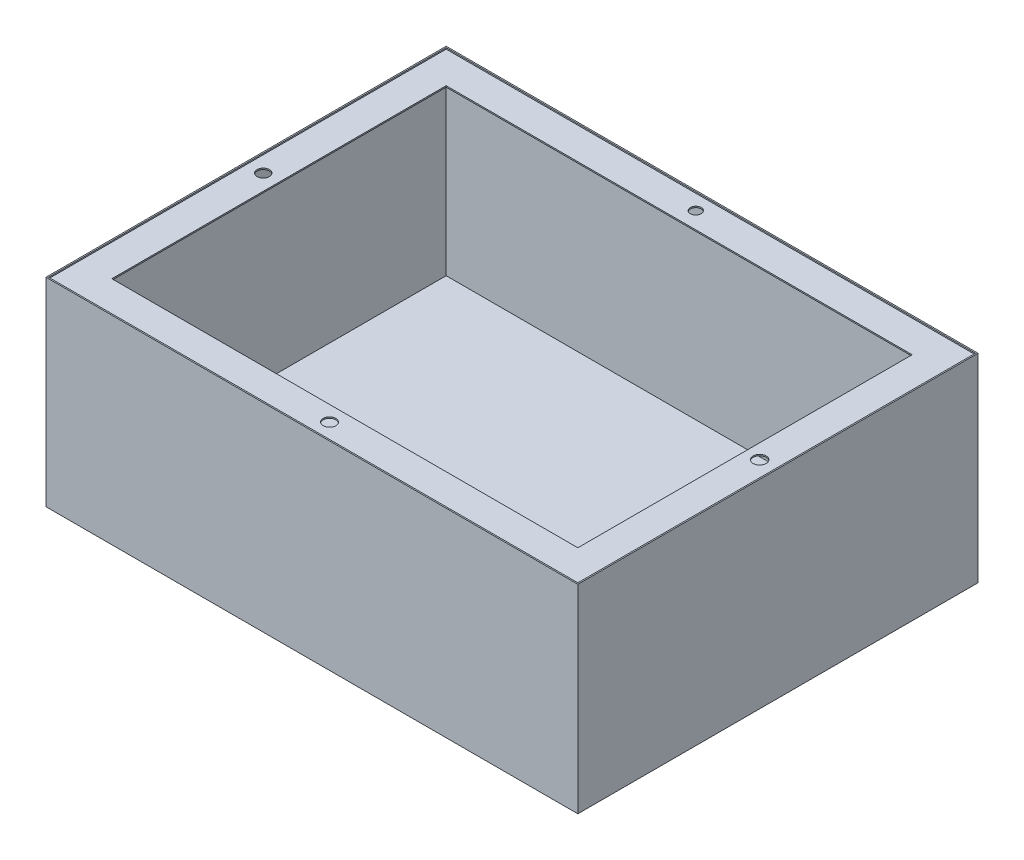
from build123d import *

# Parameters (mm, degrees)
SKETCH1_W           = 410.4
SKETCH1_H           = 308.8
BOSS_EXTRUDE2_DEPTH = 1
SKETCH5_W           = 410.4
SKETCH5_H           = 1
BOSS_EXTRUDE4_DEPTH = 152.4
SKETCH10_W          = 1
SKETCH10_H          = 308.8
EXTRUDE_THIN2_DEPTH = 152.4
SKETCH11_W          = 1
SKETCH11_H          = 307.8
SKETCH11_W_2        = 409.4
SKETCH11_H_2        = 1
EXTRUDE_THIN3_DEPTH = 152.4
SKETCH12_W          = 410.4
SKETCH12_H          = 1
EXTRUDE_THIN4_DEPTH = 25.4
SKETCH13_W          = 308.8
SKETCH13_H          = 1
EXTRUDE_THIN5_DEPTH = 25.4
SKETCH14_W          = 410.4
SKETCH14_H          = 1
EXTRUDE_THIN6_DEPTH = 25.4
SKETCH15_W          = 308.8
SKETCH15_H          = 1
EXTRUDE_THIN7_DEPTH = 25.4
SKETCH19_R          = 5.056095902
SKETCH19_R_2        = 4.737056414
SKETCH19_R_3        = 4.194334137
SKETCH19_R_4        = 4.887308366
CUT_EXTRUDE3_DEPTH  = 10


with BuildPart() as part:
    # Sketch1 → Boss-Extrude2 (new body)
    with BuildSketch(Plane(origin=(0, 0, 0), x_dir=(1, 0, 0), z_dir=(0, 1, 0))):
        Rectangle(SKETCH1_W, SKETCH1_H)
    extrude(amount=BOSS_EXTRUDE2_DEPTH)

    # Sketch5 → Boss-Extrude4 (add)
    with BuildSketch(Plane(origin=(0, 1, 0), x_dir=(1, 0, 0), z_dir=(0, 1, 0))):
        with Locations((0, -153.9)):
            Rectangle(SKETCH5_W, SKETCH5_H)
    extrude(amount=BOSS_EXTRUDE4_DEPTH)

    # Sketch10 → Extrude-Thin2 (add)
    with BuildSketch(Plane(origin=(0, 1, 0), x_dir=(1, 0, 0), z_dir=(0, 1, 0))):
        with Locations((-204.7, 0)):
            Rectangle(SKETCH10_W, SKETCH10_H)
    extrude(amount=EXTRUDE_THIN2_DEPTH)

    # Sketch11 → Extrude-Thin3 (add)
    with BuildSketch(Plane(origin=(0, 1, 0), x_dir=(1, 0, 0), z_dir=(0, 1, 0))):
        with Locations((204.7, 0.5)):
            Rectangle(SKETCH11_W, SKETCH11_H)
        with Locations((0.5, 153.9)):
            Rectangle(SKETCH11_W_2, SKETCH11_H_2)
    extrude(amount=EXTRUDE_THIN3_DEPTH)

    # Sketch12 → Extrude-Thin4 (add)
    with BuildSketch(Plane(origin=(0, 0, -154.4), x_dir=(-1, 0, 0), z_dir=(0, 0, -1))):
        with Locations((0, 151.9)):
            Rectangle(SKETCH12_W, SKETCH12_H)
    extrude(amount=-EXTRUDE_THIN4_DEPTH)

    # Sketch13 → Extrude-Thin5 (add)
    with BuildSketch(Plane.ZY.offset(205.2)):
        with Locations((0, 151.9)):
            Rectangle(SKETCH13_W, SKETCH13_H)
    extrude(amount=-EXTRUDE_THIN5_DEPTH)

    # Sketch14 → Extrude-Thin6 (add)
    with BuildSketch(Plane.XY.offset(154.4)):
        with Locations((0, 151.9)):
            Rectangle(SKETCH14_W, SKETCH14_H)
    extrude(amount=-EXTRUDE_THIN6_DEPTH)

    # Sketch15 → Extrude-Thin7 (add)
    with BuildSketch(Plane(origin=(205.2, 0, 0), x_dir=(0, 0, -1), z_dir=(1, 0, 0))):
        with Locations((0, 151.9)):
            Rectangle(SKETCH15_W, SKETCH15_H)
    extrude(amount=-EXTRUDE_THIN7_DEPTH)

    # Sketch19 → Cut-Extrude3 (cut)
    with BuildSketch(Plane(origin=(0, 152.4, 0), x_dir=(1, 0, 0), z_dir=(0, 1, 0))):
        with Locations(Location((191.104510435, 0, 0), (0, 0, 270))):
            Circle(SKETCH19_R)
        with Locations(Location((-191.953029846, 0, 0), (0, 0, 270))):
            Circle(SKETCH19_R_2)
        with Locations(Location((0, 141.834718346, 0), (0, 0, 270))):
            Circle(SKETCH19_R_3)
        with Locations(Location((0, -140.765526806, 0), (0, 0, 270))):
            Circle(SKETCH19_R_4)
    extrude(amount=-CUT_EXTRUDE3_DEPTH, mode=Mode.SUBTRACT)


solid = part.part
